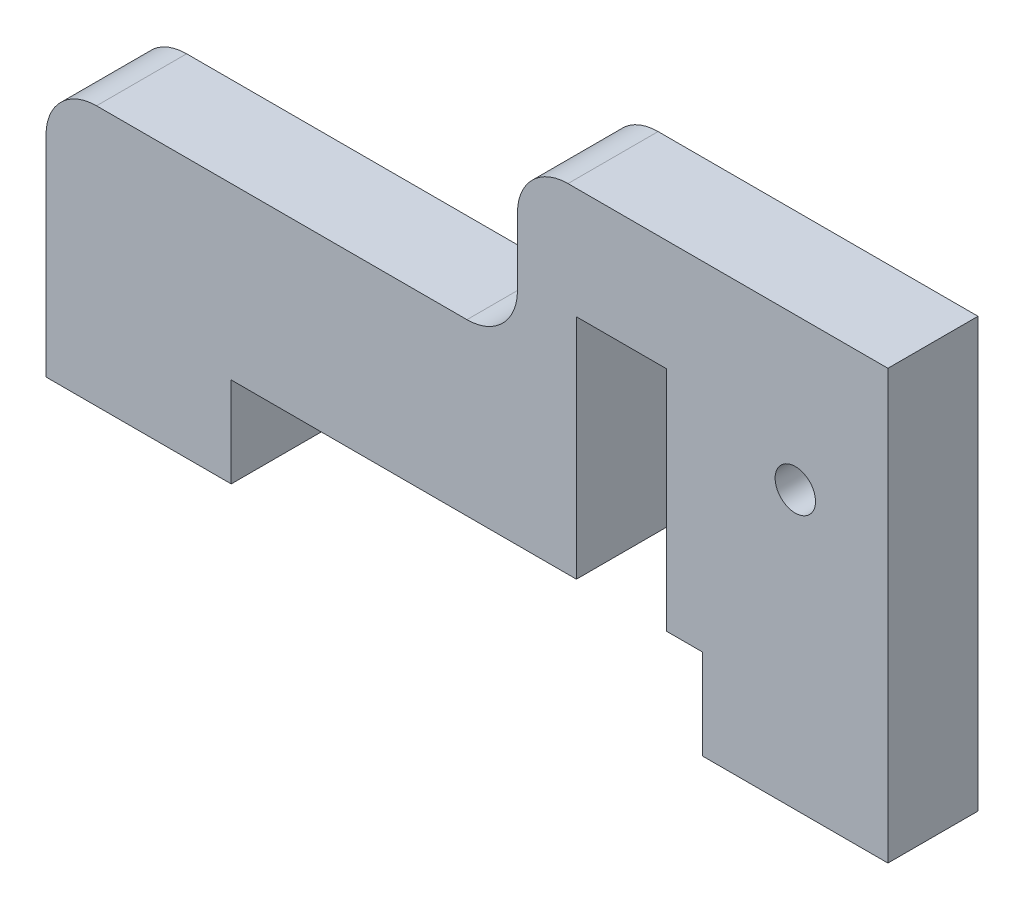
from build123d import *

# Parameters (mm, degrees)
MODEL_R             = 1.2
BOSS_EXTRUDE1_DEPTH = 5.35


with BuildPart() as part:
    # Model → Boss-Extrude1 (new body)
    with BuildSketch(Plane.XY):
        with BuildLine():
            Line((39, 0), (50, 0))
            Line((50, 0), (50, 25.45))
            Line((50, 25.45), (31, 25.45))
            ThreePointArc((31, 25.45), (28.878679656, 24.571320344), (28, 22.45))
            Line((28, 22.45), (28, 18.45))
            ThreePointArc((28, 18.45), (27.121320344, 16.328679656), (25, 15.45))
            Line((25, 15.45), (3, 15.45))
            ThreePointArc((3, 15.45), (0.878679656, 14.571320344), (0, 12.45))
            Line((0, 12.45), (0, 0))
            Line((0, 0), (11, 0))
            Line((11, 0), (11, 5.35))
            Line((11, 5.35), (31.5, 5.35))
            Line((31.5, 5.35), (31.5, 18.85))
            Line((31.5, 18.85), (36.85, 18.85))
            Line((36.85, 18.85), (36.85, 5.35))
            Line((36.85, 5.35), (39, 5.35))
            Line((39, 5.35), (39, 0))
        make_face()
        with Locations((44.5, 16.45)):
            Circle(MODEL_R, mode=Mode.SUBTRACT)
    extrude(amount=BOSS_EXTRUDE1_DEPTH)


solid = part.part
